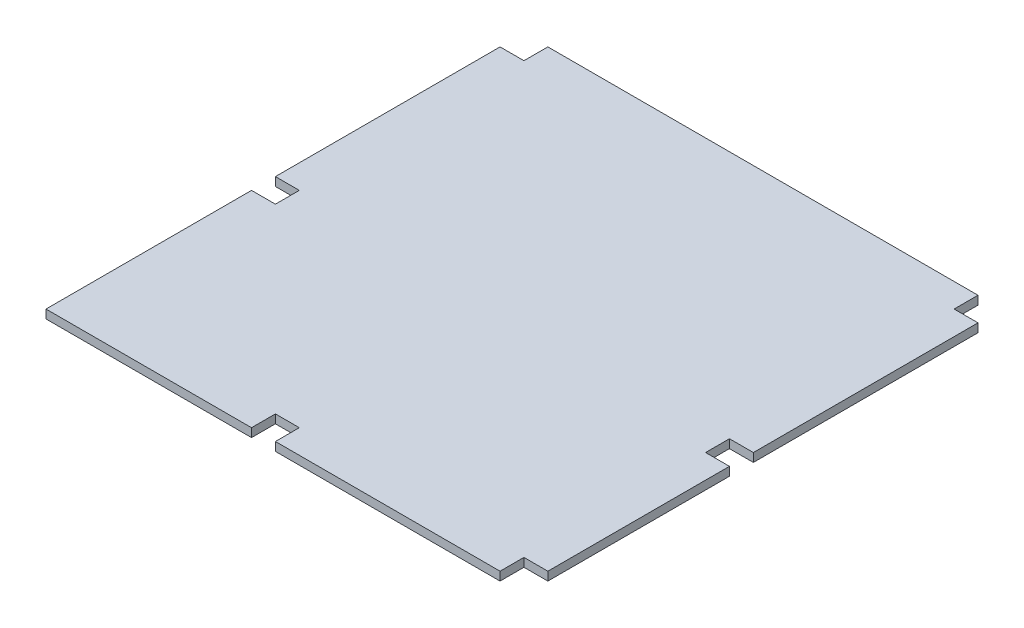
from build123d import *

# Parameters (mm, degrees)
BOSS_EXTRUDE1_DEPTH = 18


with BuildPart() as part:
    # Sketch1 → Boss-Extrude1 (new body)
    with BuildSketch(Plane(origin=(0, 0, 0), x_dir=(1, 0, 0), z_dir=(0, 1, 0))):
        Polygon((0, 300), (0, 770), (50, 770), (50, 820), (950, 820), (950, 770), (1000, 770), (1000, 300), (950, 300), (950, 250), (1000, 250), (1000, -130), (950, -130), (950, -180), (480, -180), (480, -130), (430, -130), (430, -180), (0, -180), (0, 250), (50, 250), (50, 300), align=None)
    extrude(amount=BOSS_EXTRUDE1_DEPTH)


solid = part.part
